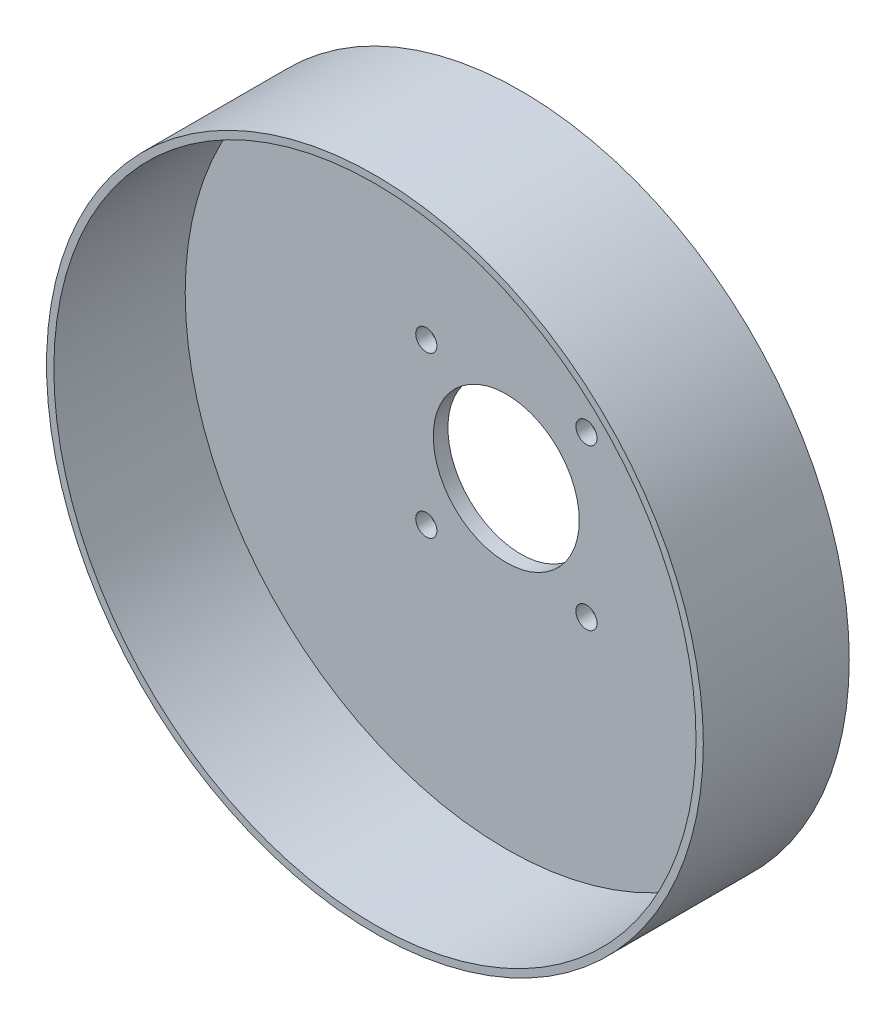
from build123d import *

# Parameters (mm, degrees)
SKETCH1_R               = 45
SKETCH1_R_2             = 44
BOSS_EXTRUDE1_DEPTH     = 18
BOSS_EXTRUDE2_START     = -2
SKETCH1_2_R             = 45
SKETCH1_2_R_2           = 44
BOSS_EXTRUDE2_DEPTH     = 2
M3_5X0_6_TAPPED_HOLE1_D = 2.9
CIRPATTERN1_COUNT       = 4
CUT_EXTRUDE1_DEPTH      = 67.708320321
CUT_EXTRUDE1_DEPTH_BACK = 67.708320321
SKETCH2_R               = 10


with BuildPart() as part:
    # Sketch1 → Boss-Extrude1 (new body)
    with BuildSketch(Plane.XY):
        Circle(SKETCH1_R)
        Circle(SKETCH1_R_2, mode=Mode.SUBTRACT)
    extrude(amount=BOSS_EXTRUDE1_DEPTH)

    # Sketch1<2> → Boss-Extrude2 (add)
    # profile 1 of 2: a face of its own
    with BuildSketch(Plane.XY.offset(BOSS_EXTRUDE2_START)):
        Circle(SKETCH1_2_R)
        Circle(SKETCH1_2_R_2, mode=Mode.SUBTRACT)
    # profile 2 of 2: a face of its own
    with BuildSketch(Plane.XY.offset(BOSS_EXTRUDE2_START)):
        Circle(SKETCH1_2_R_2)
    extrude(amount=BOSS_EXTRUDE2_DEPTH)

    # M3.5x0.6 Tapped Hole1 (through all)
    with Locations(Plane(origin=(0, 0, -2), x_dir=(-1, 0, 0), z_dir=(0, 0, -1))):
        with Locations((10.960155108, 10.960155108)):
            m3_5x0_6_tapped_hole1 = Hole(M3_5X0_6_TAPPED_HOLE1_D / 2)

    # CirPattern1: M3.5x0.6 Tapped Hole1 ×4 about axis
    cirpattern1_axis = Axis((0.011391445, -0.011391445, 0), (0, 0, 1))
    for i in range(1, CIRPATTERN1_COUNT):
        add(m3_5x0_6_tapped_hole1.rotate(cirpattern1_axis, i * 360 / CIRPATTERN1_COUNT), mode=Mode.SUBTRACT)

    # Sketch2 → Cut-Extrude1 (cut, two sides: drawn at the far end of the back side and taken through both)
    with BuildSketch(Plane(origin=(0, 0, -2), x_dir=(-1, 0, 0), z_dir=(0, 0, -1)).offset(-CUT_EXTRUDE1_DEPTH_BACK)):
        with Locations(Location((0, 0, 0), (0, 0, 180))):
            Circle(SKETCH2_R)
    extrude(amount=CUT_EXTRUDE1_DEPTH + CUT_EXTRUDE1_DEPTH_BACK, mode=Mode.SUBTRACT)


solid = part.part
